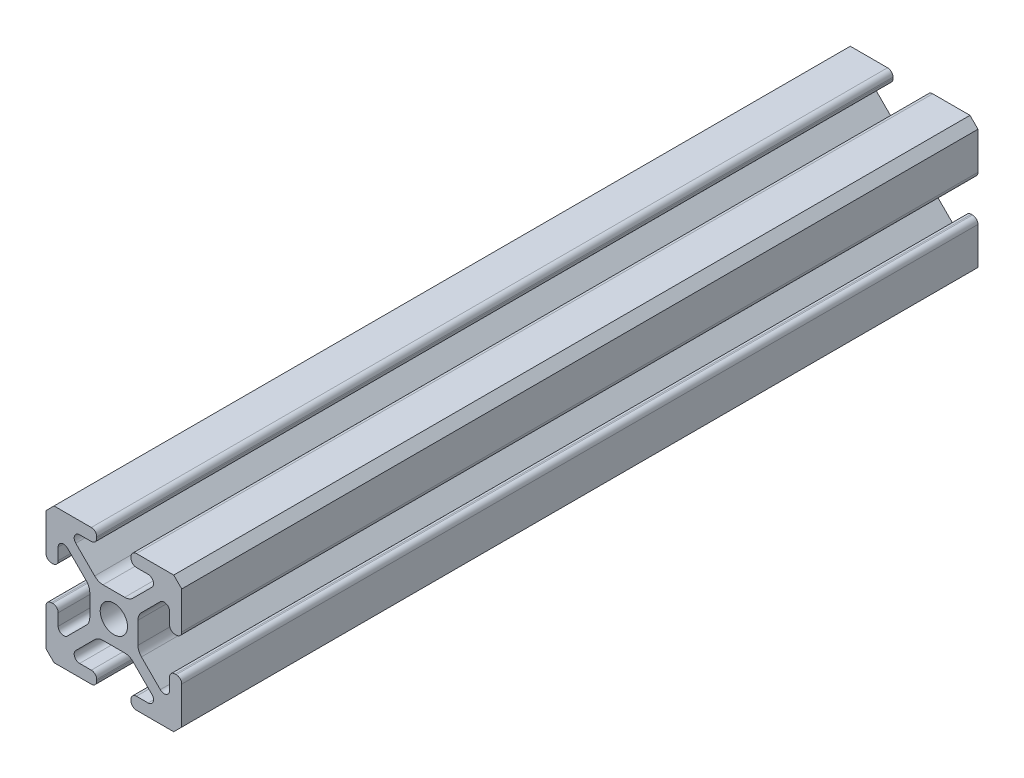
from build123d import *

# Parameters (mm, degrees)
BOSS_EXTRUDE1_DEPTH = 149


with BuildPart() as part:
    # Sketch1 → Boss-Extrude1 (new body)
    with BuildSketch(Plane.XY):
        with BuildLine():
            Line((-11.199951579, -12.7), (-4.222256762, -12.7))
            ThreePointArc((-4.222256762, -12.7), (-3.503836272, -12.40242049), (-3.206256762, -11.684))
            Line((-3.206256762, -11.684), (-3.206256762, -11.440665395))
            ThreePointArc((-3.206256762, -11.440665395), (-3.503836272, -10.722244905), (-4.222256762, -10.424665395))
            Line((-4.222256762, -10.424665395), (-6.40926672, -10.424665395))
            ThreePointArc((-6.40926672, -10.424665395), (-7.347928334, -9.797471742), (-7.127687178, -8.690244874))
            Line((-7.127687178, -8.690244874), (-3.593166694, -5.155724698))
            ThreePointArc((-3.593166694, -5.155724698), (-2.876257435, -4.67670128), (-2.030605322, -4.508490626))
            Line((-2.030605322, -4.508490626), (2.030598864, -4.508490626))
            ThreePointArc((2.030598864, -4.508490626), (2.876251031, -4.676701303), (3.593160319, -5.155724782))
            Line((3.593160319, -5.155724782), (7.127680379, -8.690244912))
            ThreePointArc((7.127680379, -8.690244912), (7.347921489, -9.019859032), (7.425259882, -9.408665395))
            ThreePointArc((7.425259882, -9.408665395), (7.127680372, -10.127085884), (6.409259882, -10.424665395))
            Line((6.409259882, -10.424665395), (4.22225065, -10.424665395))
            ThreePointArc((4.22225065, -10.424665395), (3.50383016, -10.722244905), (3.20625065, -11.440665395))
            Line((3.20625065, -11.440665395), (3.20625065, -11.684))
            ThreePointArc((3.20625065, -11.684), (3.50383016, -12.40242049), (4.22225065, -12.7))
            Line((4.22225065, -12.7), (11.199952422, -12.7))
            Line((11.199952422, -12.7), (12.7, -11.199951732))
            Line((12.7, -11.199951732), (12.7, -4.222256762))
            ThreePointArc((12.7, -4.222256762), (12.40242049, -3.503836272), (11.684, -3.206256762))
            Line((11.684, -3.206256762), (11.440665395, -3.206256762))
            ThreePointArc((11.440665395, -3.206256762), (10.722244905, -3.503836272), (10.424665395, -4.222256762))
            Line((10.424665395, -4.222256762), (10.424665395, -6.40926672))
            ThreePointArc((10.424665395, -6.40926672), (9.797471742, -7.347928334), (8.690244874, -7.127687178))
            Line((8.690244874, -7.127687178), (5.155724698, -3.593166694))
            ThreePointArc((5.155724698, -3.593166694), (4.67670128, -2.876257435), (4.508490626, -2.030605322))
            Line((4.508490626, -2.030605322), (4.508490626, 2.030598864))
            ThreePointArc((4.508490626, 2.030598864), (4.676701303, 2.876251031), (5.155724782, 3.593160319))
            Line((5.155724782, 3.593160319), (8.690244912, 7.127680379))
            ThreePointArc((8.690244912, 7.127680379), (9.019859032, 7.347921489), (9.408665395, 7.425259882))
            ThreePointArc((9.408665395, 7.425259882), (10.127085884, 7.127680372), (10.424665395, 6.409259882))
            Line((10.424665395, 6.409259882), (10.424665395, 4.22225065))
            ThreePointArc((10.424665395, 4.22225065), (10.722244905, 3.50383016), (11.440665395, 3.20625065))
            Line((11.440665395, 3.20625065), (11.684, 3.20625065))
            ThreePointArc((11.684, 3.20625065), (12.40242049, 3.50383016), (12.7, 4.22225065))
            Line((12.7, 4.22225065), (12.7, 11.199954756))
            Line((12.7, 11.199954756), (11.199954423, 12.7))
            Line((11.199954423, 12.7), (4.222256762, 12.7))
            ThreePointArc((4.222256762, 12.7), (3.503836272, 12.40242049), (3.206256762, 11.684))
            Line((3.206256762, 11.684), (3.206256762, 11.440665395))
            ThreePointArc((3.206256762, 11.440665395), (3.503836272, 10.722244905), (4.222256762, 10.424665395))
            Line((4.222256762, 10.424665395), (6.40926672, 10.424665395))
            ThreePointArc((6.40926672, 10.424665395), (7.347928334, 9.797471742), (7.127687178, 8.690244874))
            Line((7.127687178, 8.690244874), (3.593166694, 5.155724698))
            ThreePointArc((3.593166694, 5.155724698), (2.876257435, 4.67670128), (2.030605322, 4.508490626))
            Line((2.030605322, 4.508490626), (-2.030598864, 4.508490626))
            ThreePointArc((-2.030598864, 4.508490626), (-2.876251031, 4.676701303), (-3.593160319, 5.155724782))
            Line((-3.593160319, 5.155724782), (-7.127680379, 8.690244912))
            ThreePointArc((-7.127680379, 8.690244912), (-7.347921489, 9.019859032), (-7.425259882, 9.408665395))
            ThreePointArc((-7.425259882, 9.408665395), (-7.127680372, 10.127085884), (-6.409259882, 10.424665395))
            Line((-6.409259882, 10.424665395), (-4.22225065, 10.424665395))
            ThreePointArc((-4.22225065, 10.424665395), (-3.50383016, 10.722244905), (-3.20625065, 11.440665395))
            Line((-3.20625065, 11.440665395), (-3.20625065, 11.684))
            ThreePointArc((-3.20625065, 11.684), (-3.50383016, 12.40242049), (-4.22225065, 12.7))
            Line((-4.22225065, 12.7), (-11.199951733, 12.7))
            Line((-11.199951733, 12.7), (-12.7, 11.1999514))
            Line((-12.7, 11.1999514), (-12.7, 4.222256762))
            ThreePointArc((-12.7, 4.222256762), (-12.40242049, 3.503836272), (-11.684, 3.206256762))
            Line((-11.684, 3.206256762), (-11.440665395, 3.206256762))
            ThreePointArc((-11.440665395, 3.206256762), (-10.722244905, 3.503836272), (-10.424665395, 4.222256762))
            Line((-10.424665395, 4.222256762), (-10.424665395, 6.40926672))
            ThreePointArc((-10.424665395, 6.40926672), (-9.797471742, 7.347928334), (-8.690244874, 7.127687178))
            Line((-8.690244874, 7.127687178), (-5.155724698, 3.593166694))
            ThreePointArc((-5.155724698, 3.593166694), (-4.67670128, 2.876257435), (-4.508490626, 2.030605322))
            Line((-4.508490626, 2.030605322), (-4.508490626, -2.030598864))
            ThreePointArc((-4.508490626, -2.030598864), (-4.676701303, -2.876251031), (-5.155724782, -3.593160319))
            Line((-5.155724782, -3.593160319), (-8.690244912, -7.127680379))
            ThreePointArc((-8.690244912, -7.127680379), (-9.019859032, -7.347921489), (-9.408665395, -7.425259882))
            ThreePointArc((-9.408665395, -7.425259882), (-10.127085884, -7.127680372), (-10.424665395, -6.409259882))
            Line((-10.424665395, -6.409259882), (-10.424665395, -4.22225065))
            ThreePointArc((-10.424665395, -4.22225065), (-10.722244905, -3.50383016), (-11.440665395, -3.20625065))
            Line((-11.440665395, -3.20625065), (-11.684, -3.20625065))
            ThreePointArc((-11.684, -3.20625065), (-12.40242049, -3.50383016), (-12.7, -4.22225065))
            Line((-12.7, -4.22225065), (-12.7, -11.199952268))
            Line((-12.7, -11.199952268), (-11.199951579, -12.7))
        make_face()
        with BuildLine():
            ThreePointArc((-2.55499489, 0), (0, -2.55499489), (2.55499489, 0))
            ThreePointArc((2.55499489, 0), (0, 2.55499489), (-2.55499489, 0))
        make_face(mode=Mode.SUBTRACT)
    extrude(amount=BOSS_EXTRUDE1_DEPTH)


solid = part.part
